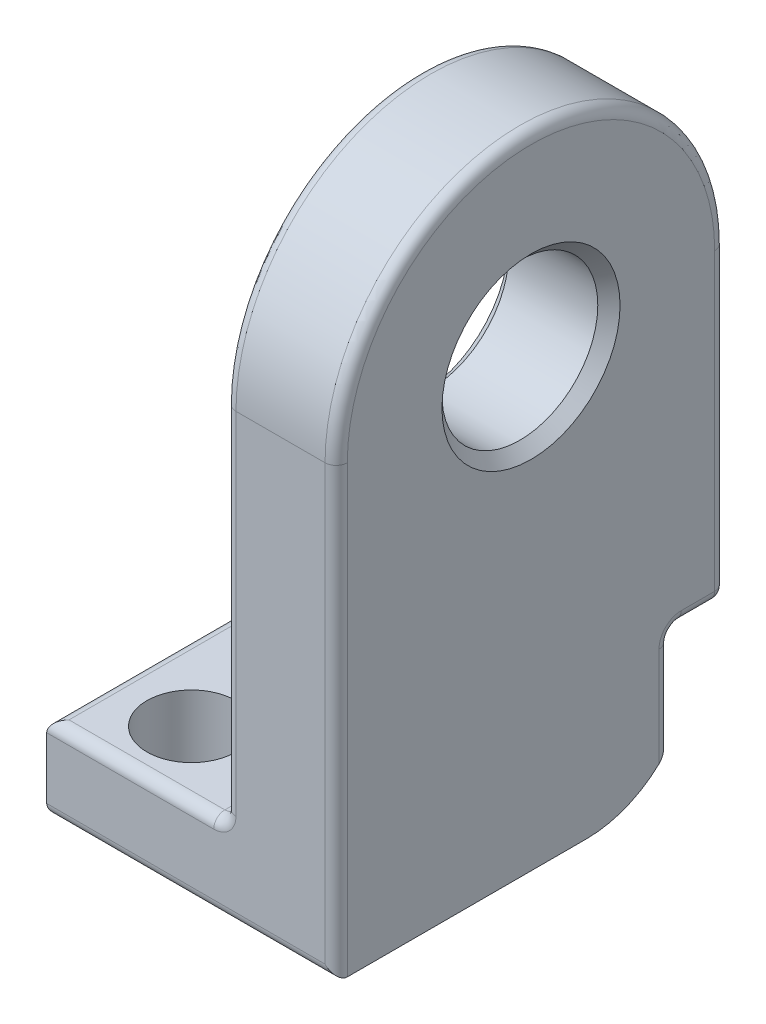
from build123d import *

# Parameters (mm, degrees)
SKETCH_1_R          = 1.4
EXTRUDE_1_DEPTH     = 2
SKETCH_2_W          = 5.2
SKETCH_2_H          = 7
SKETCH_2_R          = 0.8
EXTRUDE_2_DEPTH     = 1.5
SKETCH_5_W          = 6
SKETCH_5_H          = 1
CUT_EXTRUDE_1_DEPTH = 2.5
CUT_EXTRUDE_2_REACH = 12.163
FILLET_1_R          = 0.2
FILLET_2_R          = 0.2
CHAMFER_1_SIZE      = 0.2


with BuildPart() as part:
    # 草图1 → 凸台-拉伸1 (new body)
    with BuildSketch(Plane(origin=(0, 0, 0), x_dir=(0, 0, -1), z_dir=(1, 0, 0))):
        with BuildLine():
            Line((3.5, 0), (3.5, -8))
            Line((3.5, -8), (-3.5, -8))
            Line((-3.5, -8), (-3.5, 0))
            ThreePointArc((-3.5, 0), (0, 3.5), (3.5, 0))
        make_face()
        Circle(SKETCH_1_R, mode=Mode.SUBTRACT)
    extrude(amount=EXTRUDE_1_DEPTH)

    # 草图2 → 凸台-拉伸2 (add)
    with BuildSketch(Plane.XZ.offset(8)):
        with Locations((-0.6, 0)):
            Rectangle(SKETCH_2_W, SKETCH_2_H)
        with Locations(Location((-1.8, -1.2, 0), (0, 0, 270))):
            Circle(SKETCH_2_R, mode=Mode.SUBTRACT)
        with Locations(Location((-1.8, 2.3, 0), (0, 0, 270))):
            Circle(SKETCH_2_R, mode=Mode.SUBTRACT)
    extrude(amount=-EXTRUDE_2_DEPTH)

    # 草图5 → 切除-拉伸1 (cut)
    with BuildSketch(Plane.XZ.offset(8)):
        with Locations((-1, -3)):
            Rectangle(SKETCH_5_W, SKETCH_5_H)
    extrude(amount=-CUT_EXTRUDE_1_DEPTH, mode=Mode.SUBTRACT)

    # 草图6 → 切除-拉伸2 (cut, up to next)
    with BuildSketch(Plane.ZY.offset(3.2), mode=Mode.PRIVATE) as cut_extrude_2_sk1:
        with BuildLine():
            Line((-1, -8.325127743), (-3.27705392, -8.325127743))
            Line((-3.27705392, -8.325127743), (-3.27705392, -6))
            Line((-3.27705392, -6), (-2.897366596, -6))
            ThreePointArc((-2.897366596, -6), (-2.378404875, -7.407669683), (-1, -8))
            Line((-1, -8), (-1, -8.325127743))
        make_face()
    cut_extrude_2_tool1 = extrude(cut_extrude_2_sk1.sketch, amount=-CUT_EXTRUDE_2_REACH, mode=Mode.PRIVATE) & part.part
    add(cut_extrude_2_tool1.solids().sort_by_distance((-3.2, -7.575754, -2.569334))[0], mode=Mode.SUBTRACT)

    # 圆角1
    fillet_1_edges = [part.edges().sort_by_distance(p)[0] for p in [
        (0, -6.5, 0.5),
    ]]
    fillet(fillet_1_edges, radius=FILLET_1_R)

    # 圆角2
    fillet_2_edges = [part.edges().sort_by_distance(p)[0] for p in [
        (2, 3.5, 0),
        (2, -4, 3.5),
        (-3.2, -8, 1.25),
        (-3.2, -6.5, 0.5),
        (0, -2.75, -3.5),
        (2, -2.75, -3.5),
        (0, -3.15, 3.5),
        (1, -5.5, -2.5),
        (0, -5.9, -2.5),
        (1, -5.5, -3.5),
        (0, 3.5, 0),
        (2, -5.5, -3),
        (2, -6.383095189, -2.5),
        (0, -5.5, -3),
        (-3.2, -7.806716397, -1.834936608),
        (-0.6, -7.266190379, -2.5),
        (-0.6, -8, 3.5),
        (-1.7, -6.5, -2.5),
        (-1.7, -6.5, 3.5),
        (-0.058578644, -6.441421356, -2.5),
        (-0.058578644, -6.441421356, 3.5),
    ]]
    fillet(fillet_2_edges, radius=FILLET_2_R)

    # 倒角1
    chamfer_1_edges = [part.edges().sort_by_distance(p)[0] for p in [
        (0, 0, 1.4),
        (2, 0, 1.4),
    ]]
    chamfer(chamfer_1_edges, length=CHAMFER_1_SIZE)


solid = part.part
